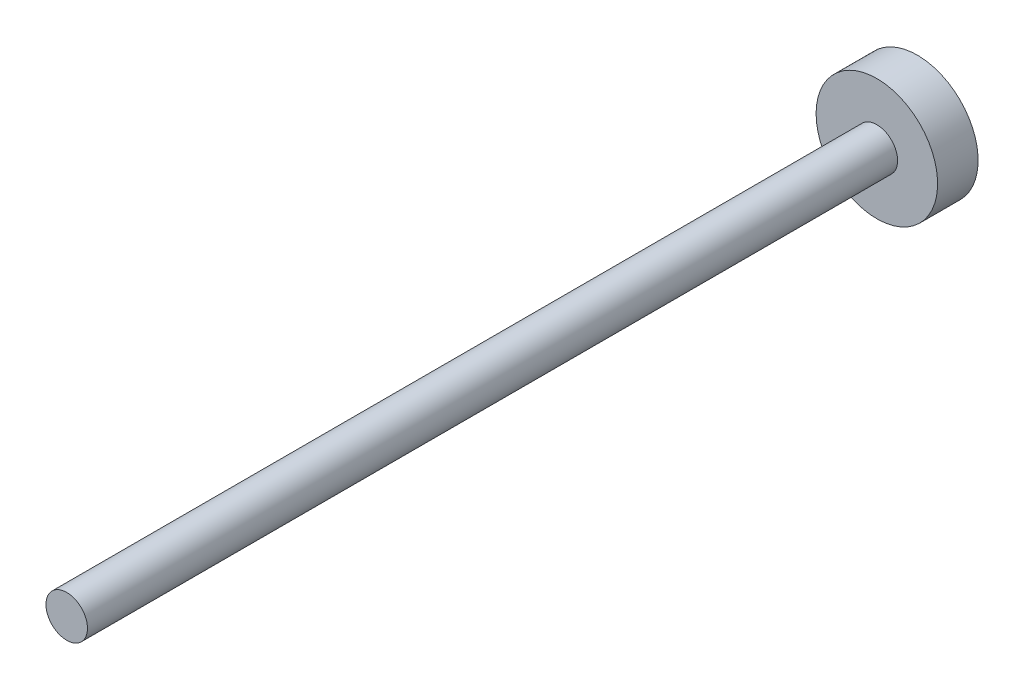
from build123d import *

# Parameters (mm, degrees)
SKETCH1_R           = 2.05
BOSS_EXTRUDE1_DEPTH = 80
SKETCH2_R           = 6
BOSS_EXTRUDE2_DEPTH = 4


with BuildPart() as part:
    # Sketch1 → Boss-Extrude1 (new body)
    with BuildSketch(Plane.XY):
        Circle(SKETCH1_R)
    extrude(amount=BOSS_EXTRUDE1_DEPTH)

    # Sketch2 → Boss-Extrude2 (add)
    with BuildSketch(Plane(origin=(0, 0, 0), x_dir=(-1, 0, 0), z_dir=(0, 0, -1))):
        Circle(SKETCH2_R)
    extrude(amount=BOSS_EXTRUDE2_DEPTH)


solid = part.part
